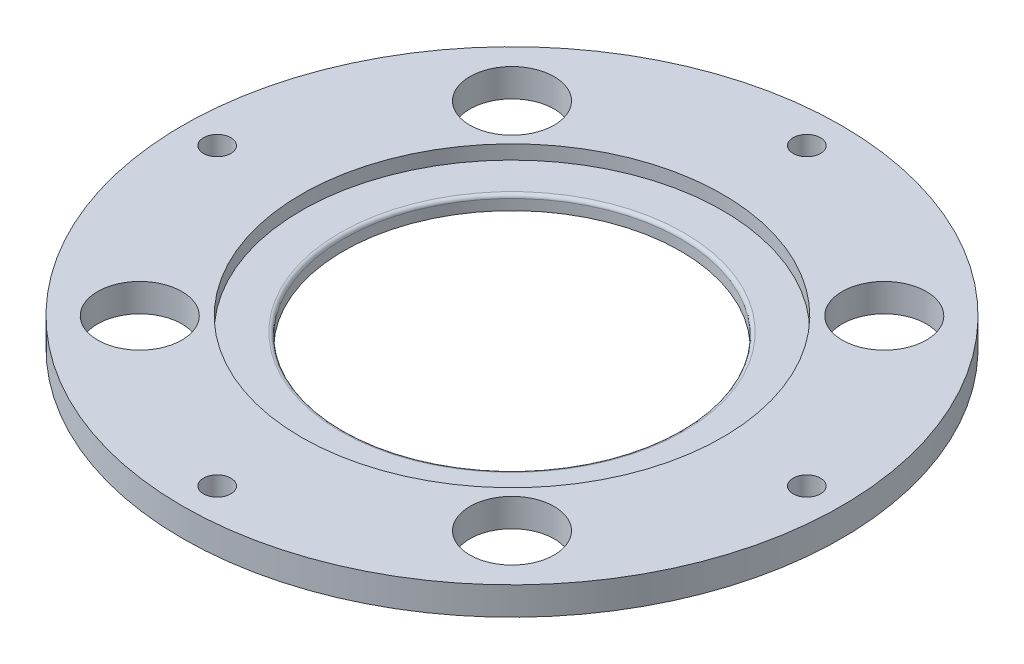
from build123d import *

# Parameters (mm, degrees)
SKETCH1_R           = 46.95
SKETCH1_R_2         = 1.95
SKETCH1_R_3         = 30
BOSS_EXTRUDE1_DEPTH = 2
SKETCH2_R           = 30
SKETCH2_R_2         = 24
BOSS_EXTRUDE2_DEPTH = 2
CUT_EXTRUDE1_START  = -33
SKETCH3_R           = 1.95
SKETCH3_R_2         = 6
CUT_EXTRUDE1_DEPTH  = 33
FILLET1_R           = 0.5


with BuildPart() as part:
    # Sketch1 → Boss-Extrude1 (new, symmetric)
    with BuildSketch(Plane(origin=(0, 0, 0), x_dir=(1, 0, 0), z_dir=(0, 1, 0))):
        with Locations(Location((0, 0, 0), (0, 0, 270))):
            Circle(SKETCH1_R)
        with Locations(Location((0, 42, 0), (0, 0, 270))):
            Circle(SKETCH1_R_2, mode=Mode.SUBTRACT)
        with Locations(Location((42, 0, 0), (0, 0, 270))):
            Circle(SKETCH1_R_2, mode=Mode.SUBTRACT)
        with Locations(Location((0, -42, 0), (0, 0, 270))):
            Circle(SKETCH1_R_2, mode=Mode.SUBTRACT)
        with Locations(Location((-42, 0, 0), (0, 0, 270))):
            Circle(SKETCH1_R_2, mode=Mode.SUBTRACT)
        with Locations(Location((0, 0, 0), (0, 0, 270))):
            Circle(SKETCH1_R_3, mode=Mode.SUBTRACT)
    extrude(amount=BOSS_EXTRUDE1_DEPTH, both=True)

    # Sketch2 → Boss-Extrude2 (add)
    with BuildSketch(Plane.XZ.offset(2)):
        with Locations(Location((0, 0, 0), (0, 0, 90))):
            Circle(SKETCH2_R)
        with Locations(Location((0, 0, 0), (0, 0, 270))):
            Circle(SKETCH2_R_2, mode=Mode.SUBTRACT)
    extrude(amount=-BOSS_EXTRUDE2_DEPTH)

    # Sketch3 → Cut-Extrude1 (cut)
    with BuildSketch(Plane(origin=(0, 2, 0), x_dir=(1, 0, 0), z_dir=(0, 1, 0)).offset(CUT_EXTRUDE1_START)):
        with Locations(Location((-42, 0, 0), (0, 0, 270))):
            Circle(SKETCH3_R)
        with Locations(Location((-26.516504294, 26.516504294, 0), (0, 0, 270))):
            Circle(SKETCH3_R_2)
        with Locations(Location((26.516504294, 26.516504294, 0), (0, 0, 270))):
            Circle(SKETCH3_R_2)
        with Locations(Location((26.516504294, -26.516504294, 0), (0, 0, 270))):
            Circle(SKETCH3_R_2)
        with Locations(Location((-26.516504294, -26.516504294, 0), (0, 0, 270))):
            Circle(SKETCH3_R_2)
    extrude(amount=CUT_EXTRUDE1_DEPTH, mode=Mode.SUBTRACT)

    # Fillet1
    fillet1_edges = [part.edges().sort_by_distance(p)[0] for p in [
        (0, 0, 24),
    ]]
    fillet(fillet1_edges, radius=FILLET1_R)


solid = part.part
